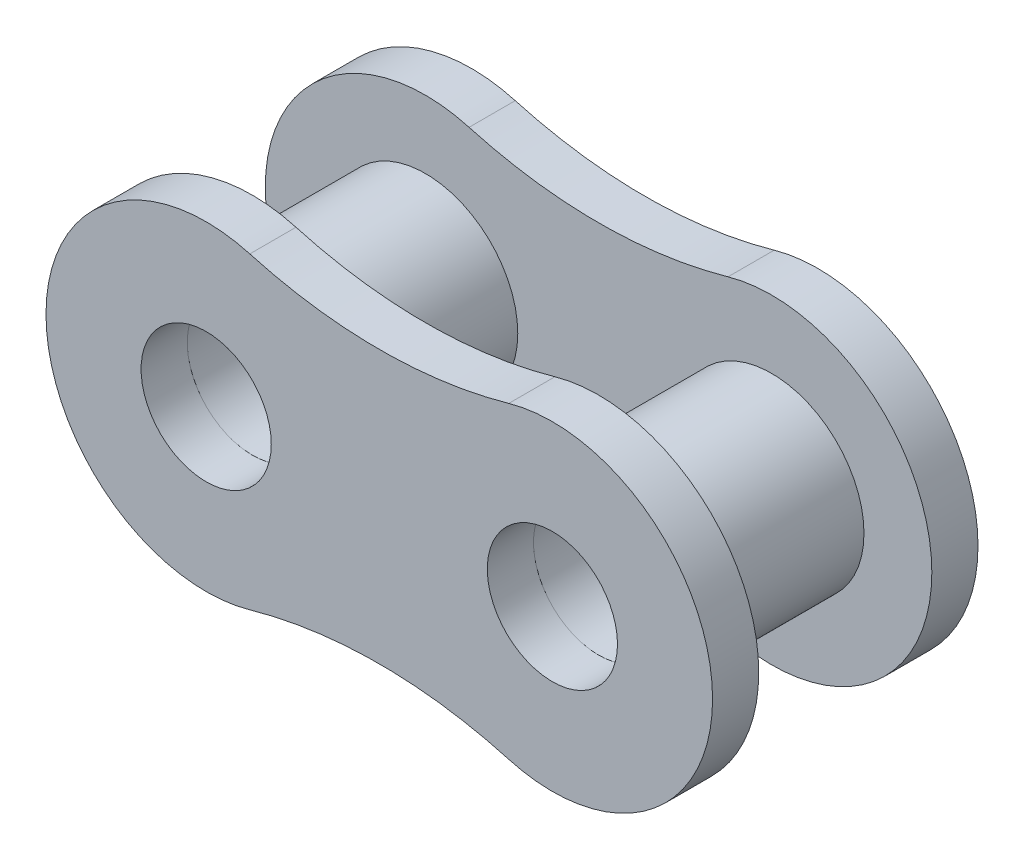
from build123d import *

# Parameters (mm, degrees)
SKETCH4_R             = 2.54
SKETCH4_R_2           = 1.8161
BOSS_EXTRUDE1_DEPTH   = 2.38125
BOSS_EXTRUDE1_2_DEPTH = 2.38125
SKETCH5_R             = 1.7907
BOSS_EXTRUDE2_DEPTH   = 1.27


with BuildPart() as part:
    # Sketch4 → Boss-Extrude1 (new, symmetric)
    with BuildSketch(Plane.XY):
        with Locations(Location((-4.7625, 0, 0), (0, 0, 180))):
            Circle(SKETCH4_R)
        with Locations(Location((-4.7625, 0, 0), (0, 0, 180))):
            Circle(SKETCH4_R_2, mode=Mode.SUBTRACT)
    extrude(amount=BOSS_EXTRUDE1_DEPTH, both=True)


with BuildPart() as body_2:
    # Sketch4 → Boss-Extrude1 2 (new, symmetric)
    with BuildSketch(Plane.XY):
        with Locations(Location((4.7625, 0, 0), (0, 0, 180))):
            Circle(SKETCH4_R)
        with Locations(Location((4.7625, 0, 0), (0, 0, 180))):
            Circle(SKETCH4_R_2, mode=Mode.SUBTRACT)
    extrude(amount=BOSS_EXTRUDE1_2_DEPTH, both=True)


with BuildPart() as body_3:
    # Sketch5 → Boss-Extrude2 (new body)
    with BuildSketch(Plane.XY.offset(2.38125)):
        with BuildLine():
            ThreePointArc((-3.562267566, 4.240307738), (-9.1694, 0), (-3.562267566, -4.240307738))
            ThreePointArc((-3.562267566, -4.240307738), (0, -3.745865), (3.562267566, -4.240307738))
            ThreePointArc((3.562267566, -4.240307738), (9.1694, 0), (3.562267566, 4.240307738))
            ThreePointArc((3.562267566, 4.240307738), (0, 3.745865), (-3.562267566, 4.240307738))
        make_face()
        with Locations((-4.7625, 0)):
            Circle(SKETCH5_R, mode=Mode.SUBTRACT)
        with Locations((4.7625, 0)):
            Circle(SKETCH5_R, mode=Mode.SUBTRACT)
    extrude(amount=BOSS_EXTRUDE2_DEPTH)


with BuildPart() as body_4:
    # Mirror3: mirrored copy
    add(body_3.part.mirror(Plane.XY))

    # Combine2: union body 3, body 2, part
    add(body_3.part)
    add(body_2.part)
    add(part.part)


solid = body_4.part
